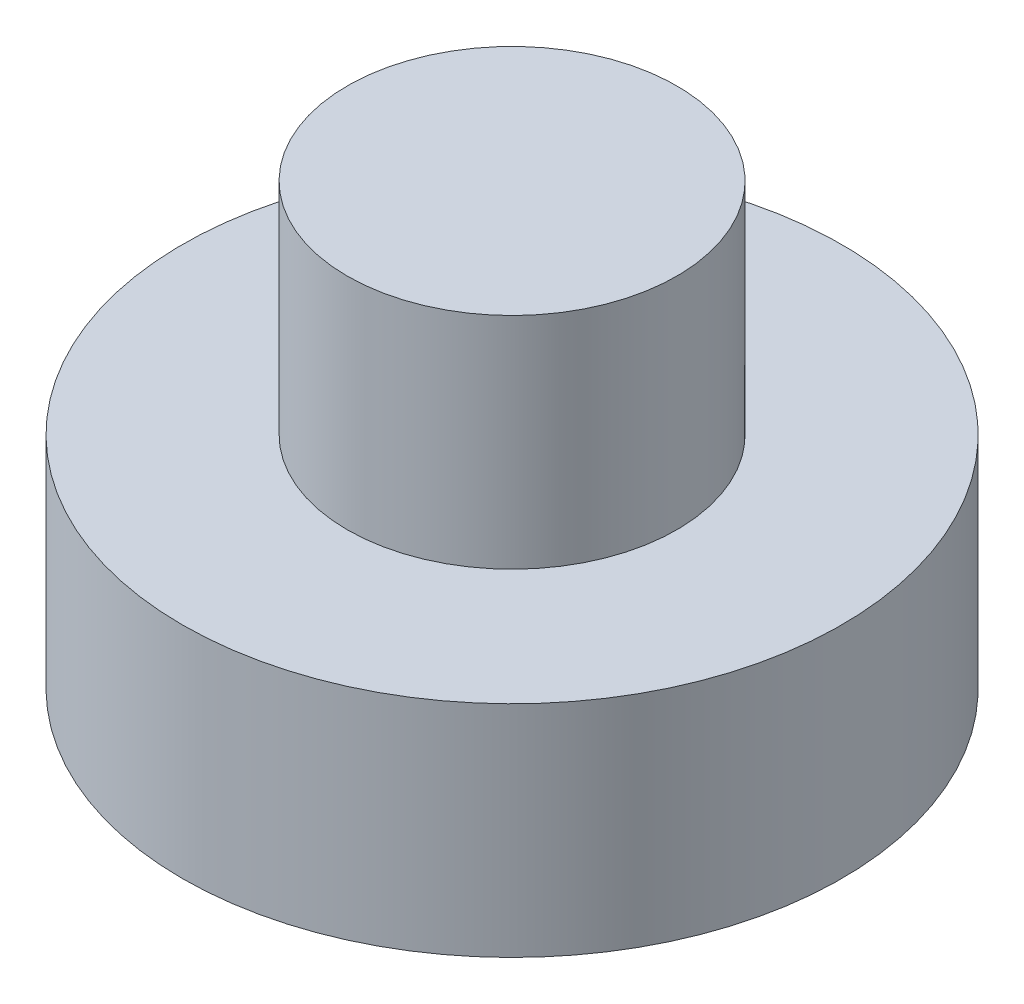
from build123d import *

# Parameters (mm, degrees)
SKETCH_1_R      = 30
EXTRUDE_1_DEPTH = 20
SKETCH_2_R      = 15
EXTRUDE_2_DEPTH = 20


with BuildPart() as part:
    # Эскиз1 → Бобышка-Вытянуть1 (new body)
    with BuildSketch(Plane(origin=(0, 0, 0), x_dir=(1, 0, 0), z_dir=(0, 1, 0))):
        with Locations(Location((0, 0, 0), (0, 0, 270))):
            Circle(SKETCH_1_R)
    extrude(amount=EXTRUDE_1_DEPTH)

    # Эскиз2 → Бобышка-Вытянуть2 (add)
    with BuildSketch(Plane(origin=(0, 20, 0), x_dir=(1, 0, 0), z_dir=(0, 1, 0))):
        with Locations(Location((0, 0, 0), (0, 0, 270))):
            Circle(SKETCH_2_R)
    extrude(amount=EXTRUDE_2_DEPTH)


solid = part.part
